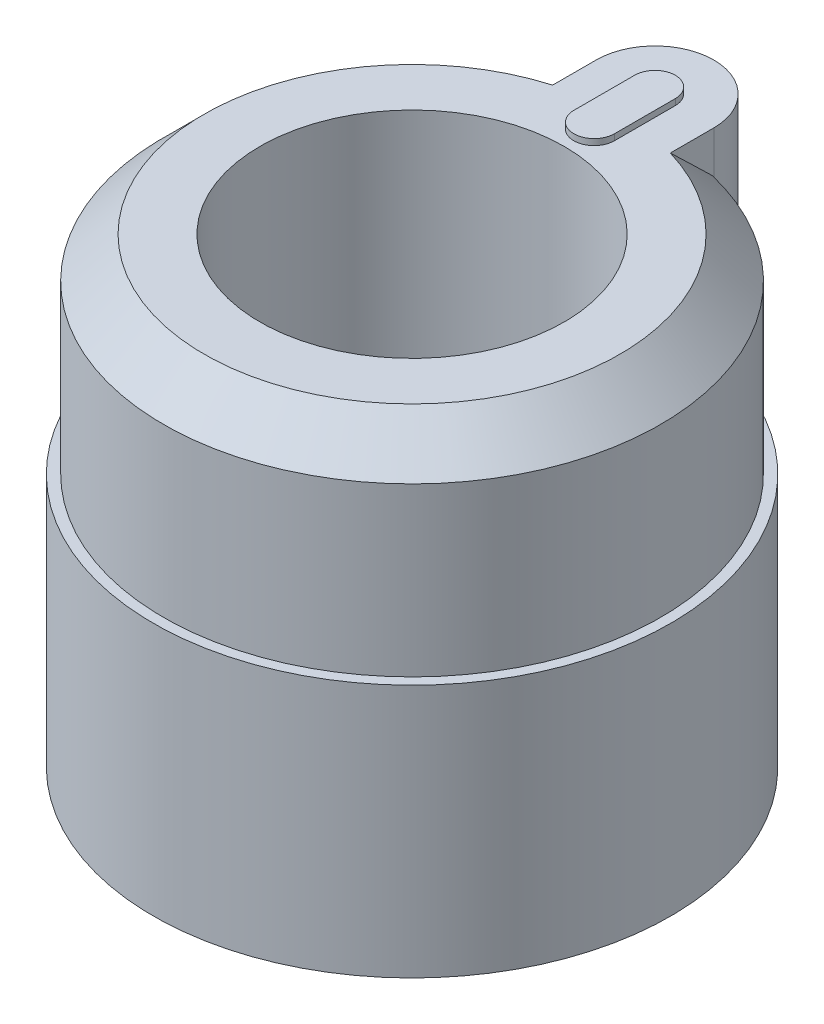
from build123d import *

# Parameters (mm, degrees)
SKETCH1_W                      = 12.75
SKETCH1_H                      = 12.5
BOSS_EXTRUDE1_DEPTH            = 10.24
BOSS_EXTRUDE2_DEPTH            = 0.3
F_15_0_15_DIAMETER_HOLE1_D     = 15
F_15_0_15_DIAMETER_HOLE1_DEPTH = 23.04
CHAMFER1_SIZE                  = 2


with BuildPart() as part:
    # Sketch1 → Revolve1 (revolve)
    with BuildSketch(Plane.XY, mode=Mode.PRIVATE) as revolve1_sk:
        with Locations((6.375, 18.15)):
            Rectangle(SKETCH1_W, SKETCH1_H)
    revolve(revolve1_sk.sketch.rotate(Axis((0, 24.4, 0), (0, -1, 0)), 270), axis=Axis((0, 24.4, 0), (0, -1, 0)))

    # Sketch2 → Boss-Extrude1 (add)
    with BuildSketch(Plane(origin=(0, 24.4, 0), x_dir=(-1, 0, 0), z_dir=(0, 1, 0))):
        with BuildLine():
            Line((2.9, -11.90178558), (2.9, -11.975))
            ThreePointArc((2.9, -11.975), (0, -14.875), (-2.9, -11.975))
            Line((-2.9, -11.975), (-2.9, -11.90178558))
            ThreePointArc((-2.9, -11.90178558), (0, 12.25), (2.9, -11.90178558))
        make_face()
    extrude(amount=BOSS_EXTRUDE1_DEPTH)

    # Sketch3 → Boss-Extrude2 (add)
    with BuildSketch(Plane(origin=(0, 34.64, 0), x_dir=(-1, 0, 0), z_dir=(0, 1, 0))):
        with BuildLine():
            Line((1, -8.975), (1, -11.975))
            ThreePointArc((1, -11.975), (0, -12.975), (-1, -11.975))
            Line((-1, -11.975), (-1, -8.975))
            ThreePointArc((-1, -8.975), (0, -7.975), (1, -8.975))
        make_face()
    extrude(amount=BOSS_EXTRUDE2_DEPTH)

    # Ø15.0 (15) Diameter Hole1
    with Locations(Plane(origin=(0, 11.9, 0), x_dir=(-1, 0, 0), z_dir=(0, -1, 0))):
        with Locations((0, 0)):
            Hole(F_15_0_15_DIAMETER_HOLE1_D / 2, depth=F_15_0_15_DIAMETER_HOLE1_DEPTH)

    # Chamfer1
    chamfer1_edges = [part.edges().sort_by_distance(p)[0] for p in [
        (0, 34.64, 12.25),
    ]]
    chamfer(chamfer1_edges, length=CHAMFER1_SIZE)


solid = part.part
